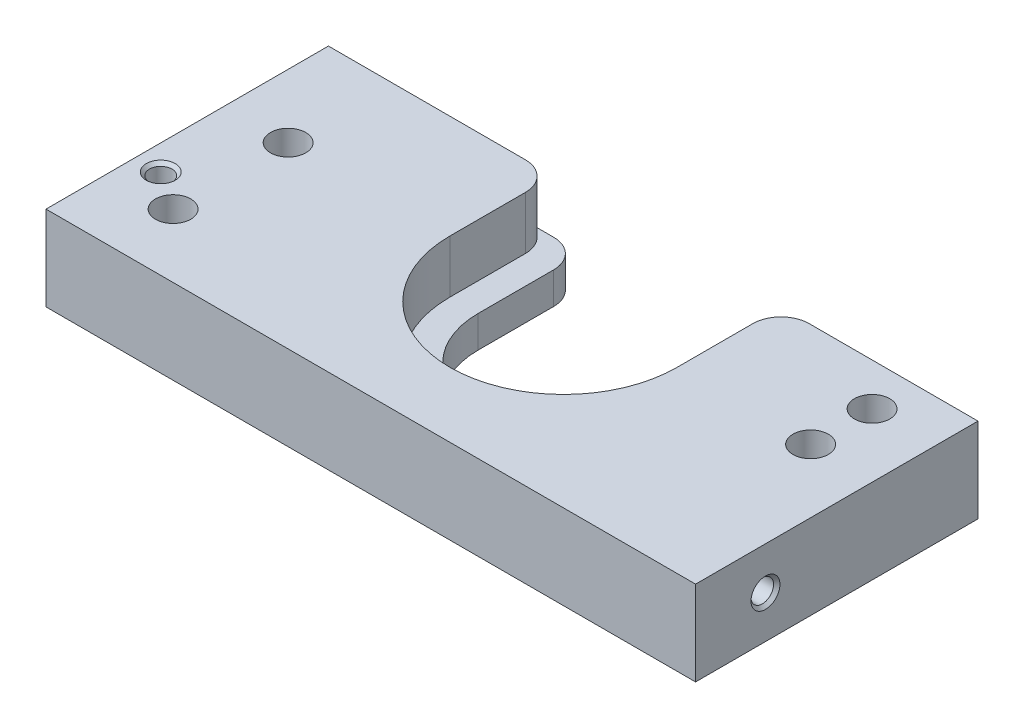
from build123d import *

# Parameters (mm, degrees)
SKETCH3_R                   = 1.25
BOSS_EXTRUDE1_DEPTH         = 6
CUT_EXTRUDE1_DEPTH          = 3.75
M2_TAPPED_HOLE1_D           = 1.6
M2_TAPPED_HOLE1_DEPTH       = 8
M2_TAPPED_HOLE1_CSINK_D     = 2.05
M2_TAPPED_HOLE1_CSINK_ANGLE = 90
M2_TAPPED_HOLE1_TIP         = 0.480688495
M2_TAPPED_HOLE2_D           = 1.6
M2_TAPPED_HOLE2_DEPTH       = 8
M2_TAPPED_HOLE2_CSINK_D     = 2.05
M2_TAPPED_HOLE2_CSINK_ANGLE = 90
M2_TAPPED_HOLE2_TIP         = 0.480688495
M2_TAPPED_HOLE3_D           = 1.6
M2_TAPPED_HOLE3_DEPTH       = 6
M2_TAPPED_HOLE3_CSINK_D     = 2.05
M2_TAPPED_HOLE3_CSINK_ANGLE = 90
M2_TAPPED_HOLE3_TIP         = 0.480688495


with BuildPart() as part:
    # Sketch3 → Boss-Extrude1 (new body)
    with BuildSketch(Plane(origin=(0, 0, 0), x_dir=(1, 0, 0), z_dir=(0, 1, 0))):
        with BuildLine():
            Line((-24, 7.352825763), (-8.05, 7.352825763))
            ThreePointArc((-8.05, 7.352825763), (-6.635786438, 6.767039326), (-6.05, 5.352825763))
            Line((-6.05, 5.352825763), (-6.05, 0))
            ThreePointArc((-6.05, 0), (0, -6.05), (6.05, 0))
            Line((6.05, 0), (6.05, 5.352825763))
            ThreePointArc((6.05, 5.352825763), (6.635786438, 6.767039326), (8.05, 7.352825763))
            Line((8.05, 7.352825763), (22, 7.352825763))
            Line((22, 7.352825763), (22, -12.647174237))
            Line((22, -12.647174237), (-24, -12.647174237))
            Line((-24, -12.647174237), (-24, 7.352825763))
        make_face()
        with Locations(Location((-19.5, -8.147174237, 0), (0, 0, 270))):
            Circle(SKETCH3_R, mode=Mode.SUBTRACT)
        with Locations(Location((17.5, 4.352825763, 0), (0, 0, 270))):
            Circle(SKETCH3_R, mode=Mode.SUBTRACT)
        with Locations(Location((17.5, 0, 0), (0, 0, 270))):
            Circle(SKETCH3_R, mode=Mode.SUBTRACT)
        with Locations(Location((-19.5, 0, 0), (0, 0, 270))):
            Circle(SKETCH3_R, mode=Mode.SUBTRACT)
    extrude(amount=BOSS_EXTRUDE1_DEPTH)

    # Sketch6 → Cut-Extrude1 (cut)
    with BuildSketch(Plane(origin=(0, 6, 0), x_dir=(1, 0, 0), z_dir=(0, 1, 0))):
        with BuildLine():
            Line((-8.05, 0), (-8.05, 5.352825763))
            ThreePointArc((-8.05, 5.352825763), (-8.635786438, 6.767039326), (-10.05, 7.352825763))
            Line((-10.05, 7.352825763), (10.05, 7.352825763))
            ThreePointArc((10.05, 7.352825763), (8.635786438, 6.767039326), (8.05, 5.352825763))
            Line((8.05, 5.352825763), (8.05, 0))
            ThreePointArc((8.05, 0), (0, -8.05), (-8.05, 0))
        make_face()
    extrude(amount=-CUT_EXTRUDE1_DEPTH, mode=Mode.SUBTRACT)

    # M2 Tapped Hole1
    with Locations(Plane(origin=(22, 0, 0), x_dir=(0, 0, -1), z_dir=(1, 0, 0))):
        with Locations((-7.697174237, 3)):
            CounterSinkHole(M2_TAPPED_HOLE1_D / 2, M2_TAPPED_HOLE1_CSINK_D / 2, depth=M2_TAPPED_HOLE1_DEPTH, counter_sink_angle=M2_TAPPED_HOLE1_CSINK_ANGLE)
            with Locations((0, 0, -(M2_TAPPED_HOLE1_DEPTH + M2_TAPPED_HOLE1_TIP / 2))):  # 118° drill point
                Cone(0, M2_TAPPED_HOLE1_D / 2, M2_TAPPED_HOLE1_TIP, mode=Mode.SUBTRACT)

    # M2 Tapped Hole2
    with Locations(Plane.ZY.offset(24)):
        with Locations((10.547174237, 3)):
            CounterSinkHole(M2_TAPPED_HOLE2_D / 2, M2_TAPPED_HOLE2_CSINK_D / 2, depth=M2_TAPPED_HOLE2_DEPTH, counter_sink_angle=M2_TAPPED_HOLE2_CSINK_ANGLE)
            with Locations((0, 0, -(M2_TAPPED_HOLE2_DEPTH + M2_TAPPED_HOLE2_TIP / 2))):  # 118° drill point
                Cone(0, M2_TAPPED_HOLE2_D / 2, M2_TAPPED_HOLE2_TIP, mode=Mode.SUBTRACT)

    # M2 Tapped Hole3
    with Locations(Plane(origin=(0, 6, 0), x_dir=(1, 0, 0), z_dir=(0, 1, 0))):
        with Locations((-22.216954316, -6.30420158)):
            CounterSinkHole(M2_TAPPED_HOLE3_D / 2, M2_TAPPED_HOLE3_CSINK_D / 2, depth=M2_TAPPED_HOLE3_DEPTH, counter_sink_angle=M2_TAPPED_HOLE3_CSINK_ANGLE)
            with Locations((0, 0, -(M2_TAPPED_HOLE3_DEPTH + M2_TAPPED_HOLE3_TIP / 2))):  # 118° drill point
                Cone(0, M2_TAPPED_HOLE3_D / 2, M2_TAPPED_HOLE3_TIP, mode=Mode.SUBTRACT)


solid = part.part
